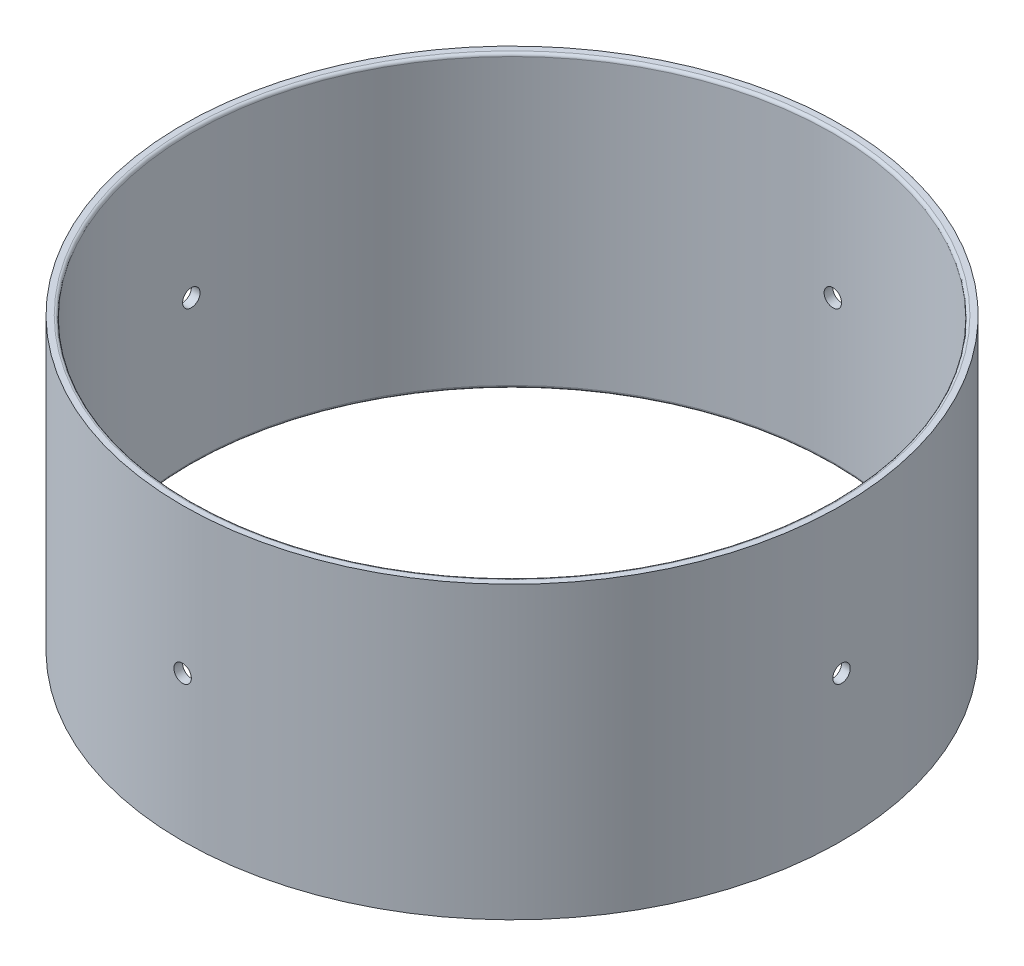
from build123d import *

# Parameters (mm, degrees)
SKETCH1_R           = 56.7
SKETCH1_R_2         = 55.2
BOSS_EXTRUDE1_DEPTH = 50
FILLET1_R           = 0.5
SKETCH2_R           = 1.5
CUT_EXTRUDE1_DEPTH  = 10
CIRPATTERN1_COUNT   = 4


with BuildPart() as part:
    # Sketch1 → Boss-Extrude1 (new body)
    with BuildSketch(Plane(origin=(0, 0, 0), x_dir=(1, 0, 0), z_dir=(0, 1, 0))):
        with Locations(Location((0, 0, 0), (0, 0, 270))):
            Circle(SKETCH1_R)
        with Locations(Location((0, 0, 0), (0, 0, 270))):
            Circle(SKETCH1_R_2, mode=Mode.SUBTRACT)
    extrude(amount=BOSS_EXTRUDE1_DEPTH)

    # Fillet1
    fillet1_edges = [part.edges().sort_by_distance(p)[0] for p in [
        (0, 0, -55.2),
        (0, 50, -55.2),
    ]]
    fillet(fillet1_edges, radius=FILLET1_R)

    # Sketch2 → Cut-Extrude1 (cut)
    with BuildSketch(Plane(origin=(56.7, 0, 0), x_dir=(0, 0, -1), z_dir=(1, 0, 0))):
        with Locations((0, 25)):
            Circle(SKETCH2_R)
    cut_extrude1 = extrude(amount=-CUT_EXTRUDE1_DEPTH, mode=Mode.SUBTRACT)

    # CirPattern1: Cut-Extrude1 ×4 about axis
    cirpattern1_axis = Axis((0, 48.063508327, 0), (0, -1, 0))
    for i in range(1, CIRPATTERN1_COUNT):
        add(cut_extrude1.rotate(cirpattern1_axis, i * 360 / CIRPATTERN1_COUNT), mode=Mode.SUBTRACT)


solid = part.part
